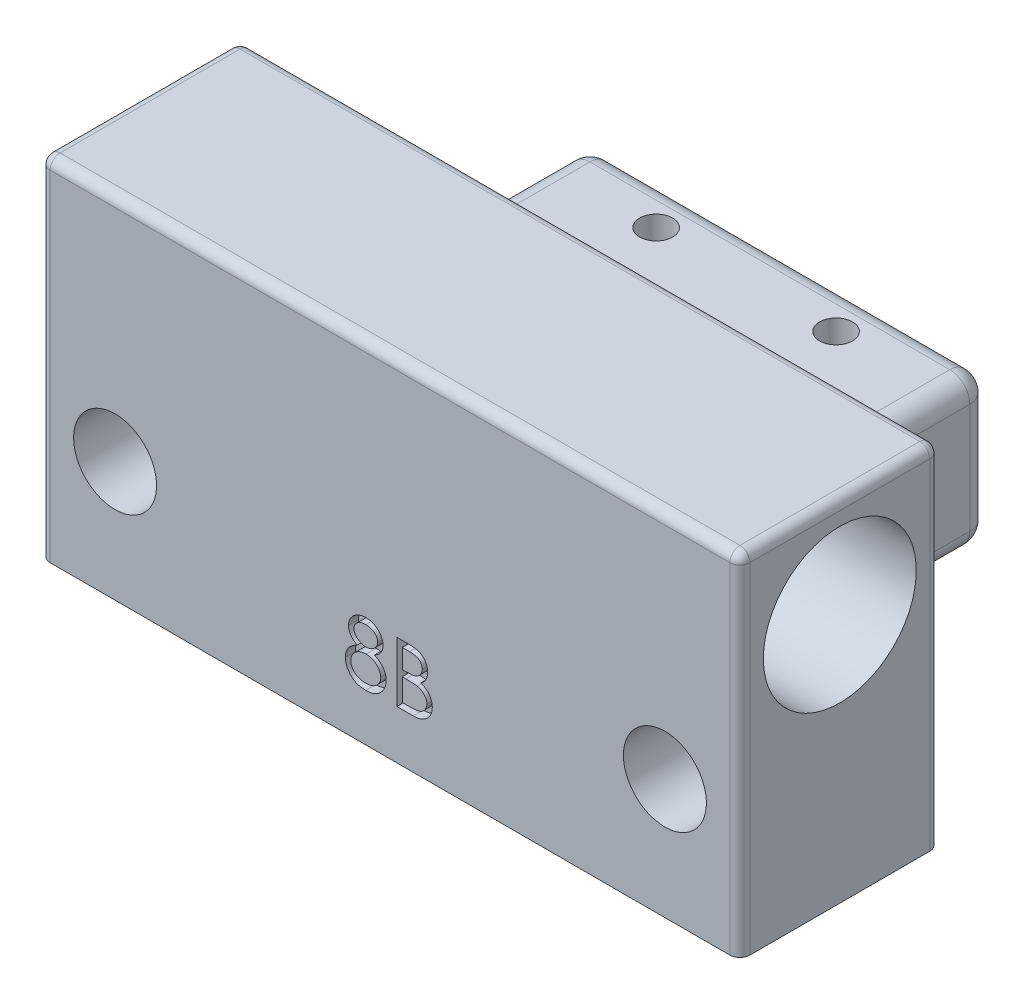
from build123d import *

# Parameters (mm, degrees)
CROQUIS1_W              = 70
CROQUIS1_H              = 20
SALIENTE_EXTRUIR1_DEPTH = 35
CROQUIS2_R              = 7.65
CORTAR_EXTRUIR1_DEPTH   = 79.89866919
CROQUIS3_R              = 4.15
CORTAR_EXTRUIR2_DEPTH   = 54.38539126
REDONDEO1_R             = 1
CROQUIS5_W              = 40
CROQUIS5_H              = 15
SALIENTE_EXTRUIR3_DEPTH = 20
REDONDEO3_R             = 2
CORTAR_EXTRUIR3_REACH   = 53.844
CROQUIS6_R              = 1.65
CORTAR_EXTRUIR4_DEPTH   = 1


with BuildPart() as part:
    # Croquis1 → Saliente-Extruir1 (new body)
    with BuildSketch(Plane(origin=(0, 0, 0), x_dir=(1, 0, 0), z_dir=(0, 1, 0))):
        Rectangle(CROQUIS1_W, CROQUIS1_H)
    extrude(amount=SALIENTE_EXTRUIR1_DEPTH)

    # Croquis2 → Cortar-Extruir1 (cut, through all)
    with BuildSketch(Plane.ZY.offset(35)):
        with Locations((0, 25)):
            Circle(CROQUIS2_R)
    extrude(amount=-CORTAR_EXTRUIR1_DEPTH, mode=Mode.SUBTRACT)

    # Croquis3 → Cortar-Extruir2 (cut, through all)
    with BuildSketch(Plane(origin=(0, 0, -10), x_dir=(-1, 0, 0), z_dir=(0, 0, -1))):
        with Locations((-27.5, 12)):
            Circle(CROQUIS3_R)
        with Locations((27.5, 12)):
            Circle(CROQUIS3_R)
    extrude(amount=-CORTAR_EXTRUIR2_DEPTH, mode=Mode.SUBTRACT)

    # Redondeo1
    redondeo1_edges = [part.edges().sort_by_distance(p)[0] for p in [
        (-35, 35, 0),
        (0, 35, 10),
        (35, 35, 0),
        (0, 35, -10),
        (35, 17.5, 10),
        (-35, 17.5, 10),
        (-35, 17.5, -10),
        (35, 17.5, -10),
    ]]
    fillet(redondeo1_edges, radius=REDONDEO1_R)

    # Croquis5 → Saliente-Extruir3 (add)
    with BuildSketch(Plane(origin=(0, 0, -10), x_dir=(-1, 0, 0), z_dir=(0, 0, -1))):
        with Locations((0, 16.2232378)):
            Rectangle(CROQUIS5_W, CROQUIS5_H)
    extrude(amount=SALIENTE_EXTRUIR3_DEPTH)

    # Redondeo3
    redondeo3_edges = [part.edges().sort_by_distance(p)[0] for p in [
        (-20, 16.2232378, -10),
        (-20, 8.7232378, -20),
        (0, 23.7232378, -10),
        (-20, 23.7232378, -20),
        (20, 16.2232378, -10),
        (20, 23.7232378, -20),
        (0, 8.7232378, -10),
        (20, 8.7232378, -20),
        (-20, 16.2232378, -30),
        (0, 23.7232378, -30),
        (20, 16.2232378, -30),
        (0, 8.7232378, -30),
    ]]
    fillet(redondeo3_edges, radius=REDONDEO3_R)

    # Croquis6 → Cortar-Extruir3 (cut, up to next)
    with BuildSketch(Plane(origin=(0, 23.7232378, 0), x_dir=(1, 0, 0), z_dir=(0, 1, 0)), mode=Mode.PRIVATE) as cortar_extruir3_sk1:
        with Locations(Location((9, 14.375, 0), (0, 0, 270))):
            Circle(CROQUIS6_R)
    cortar_extruir3_tool1 = extrude(cortar_extruir3_sk1.sketch, amount=-CORTAR_EXTRUIR3_REACH, mode=Mode.PRIVATE) & part.part
    # Croquis6 → Cortar-Extruir3 (cut, up to next)
    with BuildSketch(Plane(origin=(0, 23.7232378, 0), x_dir=(1, 0, 0), z_dir=(0, 1, 0)), mode=Mode.PRIVATE) as cortar_extruir3_sk2:
        with Locations(Location((9, 25.625, 0), (0, 0, 270))):
            Circle(CROQUIS6_R)
    cortar_extruir3_tool2 = extrude(cortar_extruir3_sk2.sketch, amount=-CORTAR_EXTRUIR3_REACH, mode=Mode.PRIVATE) & part.part
    # Croquis6 → Cortar-Extruir3 (cut, up to next)
    with BuildSketch(Plane(origin=(0, 23.7232378, 0), x_dir=(1, 0, 0), z_dir=(0, 1, 0)), mode=Mode.PRIVATE) as cortar_extruir3_sk3:
        with Locations(Location((-9, 25.625, 0), (0, 0, 270))):
            Circle(CROQUIS6_R)
    cortar_extruir3_tool3 = extrude(cortar_extruir3_sk3.sketch, amount=-CORTAR_EXTRUIR3_REACH, mode=Mode.PRIVATE) & part.part
    # Croquis6 → Cortar-Extruir3 (cut, up to next)
    with BuildSketch(Plane(origin=(0, 23.7232378, 0), x_dir=(1, 0, 0), z_dir=(0, 1, 0)), mode=Mode.PRIVATE) as cortar_extruir3_sk4:
        with Locations(Location((-9, 14.375, 0), (0, 0, 270))):
            Circle(CROQUIS6_R)
    cortar_extruir3_tool4 = extrude(cortar_extruir3_sk4.sketch, amount=-CORTAR_EXTRUIR3_REACH, mode=Mode.PRIVATE) & part.part
    add(cortar_extruir3_tool1.solids().sort_by_distance((9, 23.723238, -14.375))[0], mode=Mode.SUBTRACT)
    add(cortar_extruir3_tool2.solids().sort_by_distance((9, 23.723238, -25.625))[0], mode=Mode.SUBTRACT)
    add(cortar_extruir3_tool3.solids().sort_by_distance((-9, 23.723238, -25.625))[0], mode=Mode.SUBTRACT)
    add(cortar_extruir3_tool4.solids().sort_by_distance((-9, 23.723238, -14.375))[0], mode=Mode.SUBTRACT)

    # Croquis7 → Cortar-Extruir4 (cut)
    # profile 1 of 2: a face of its own
    with BuildSketch(Plane.XY.offset(10)):
        with BuildLine():
            add(Edge.make_bspline(
                [(-1.544471154, 8.228996938), (-1.495359359, 8.203389014), (-1.399574957, 8.153445009), (-1.263156885, 8.073026447), (-1.138485455, 7.988270507), (-1.022101634, 7.903180462), (-0.916050176, 7.814497631), (-0.821516897, 7.721869364), (-0.736166691, 7.627607743), (-0.661720776, 7.530116589), (-0.596240484, 7.429654904), (-0.539648252, 7.325959008), (-0.491275905, 7.21925615), (-0.452939438, 7.108381584), (-0.421359224, 6.994963993), (-0.399629615, 6.877538881), (-0.387943471, 6.756880011), (-0.385734076, 6.675334351), (-0.384615385, 6.634045015)],
                knots=[0, 0, 0, 0, 1.272397273, 2.481599622, 3.635517121, 4.734568067, 5.792894095, 6.808321871, 7.773003508, 8.711915296, 9.623354172, 10.525449501, 11.423591555, 12.311487226, 13.218079475, 14.126165749, 15.051214107, 16, 16, 16, 16], degree=3))
            add(Edge.make_bspline(
                [(-0.384615385, 6.634045015), (-0.38593782, 6.576277473), (-0.388555415, 6.461933833), (-0.411355388, 6.293169071), (-0.445491922, 6.129263159), (-0.495342515, 5.970252032), (-0.559994042, 5.817013106), (-0.639668618, 5.669415209), (-0.729859255, 5.52503925), (-0.802291666, 5.43620599), (-0.838942308, 5.391256554)],
                knots=[0, 0, 0, 0, 1.025265484, 2.029385089, 3.018602448, 3.995076438, 4.983346944, 5.966715145, 6.97116228, 8, 8, 8, 8], degree=3))
            add(Edge.make_bspline(
                [(-0.838942308, 5.391256554), (-0.886661978, 5.338810084), (-0.981511633, 5.234565239), (-1.143996652, 5.099220993), (-1.322319881, 4.985479175), (-1.515791309, 4.892784498), (-1.723893768, 4.820637312), (-1.946582919, 4.768792995), (-2.184292895, 4.739097402), (-2.347673703, 4.734804849), (-2.431490385, 4.732602707)],
                knots=[0, 0, 0, 0, 0.954267603, 1.896743057, 2.838368354, 3.796610408, 4.779680527, 5.799409237, 6.871065594, 8, 8, 8, 8], degree=3))
            add(Edge.make_bspline(
                [(-2.431490385, 4.732602707), (-2.512084765, 4.734578384), (-2.668913243, 4.73842285), (-2.897183891, 4.764470447), (-3.109966296, 4.810118218), (-3.30849767, 4.872594691), (-3.491581145, 4.953869368), (-3.658695032, 5.05502664), (-3.812250413, 5.171994827), (-3.947587225, 5.308133247), (-4.067738843, 5.453946742), (-4.173284077, 5.604378073), (-4.261011069, 5.759440972), (-4.335286089, 5.916823316), (-4.392145557, 6.078731008), (-4.431526489, 6.244331031), (-4.456536741, 6.413334133), (-4.459864401, 6.527388396), (-4.461538462, 6.584766169)],
                knots=[0, 0, 0, 0, 1.256902934, 2.445805442, 3.576955095, 4.645999104, 5.686449165, 6.692658513, 7.68621702, 8.689161843, 9.678783111, 10.630372946, 11.551080876, 12.453998257, 13.34127905, 14.221779781, 15.105423033, 16, 16, 16, 16], degree=3))
            add(Edge.make_bspline(
                [(-4.461538462, 6.584766169), (-4.460547808, 6.626867641), (-4.458589928, 6.71007501), (-4.44503876, 6.833005287), (-4.423252826, 6.952655804), (-4.393665186, 7.069468507), (-4.353566283, 7.182592974), (-4.305151198, 7.292565215), (-4.248696422, 7.399509385), (-4.183414425, 7.504010324), (-4.107468098, 7.604603773), (-4.02147327, 7.702996907), (-3.923711209, 7.797662965), (-3.815269508, 7.88975855), (-3.697387441, 7.980917362), (-3.567003103, 8.066212897), (-3.427572929, 8.151683694), (-3.328477948, 8.20278368), (-3.277644231, 8.228996938)],
                knots=[0, 0, 0, 0, 0.941657376, 1.861047343, 2.762797495, 3.66048619, 4.553285746, 5.444104102, 6.34607688, 7.256116206, 8.197091036, 9.162375105, 10.176350973, 11.237807142, 12.343728897, 13.50695164, 14.721116704, 16, 16, 16, 16], degree=3))
            add(Edge.make_bspline(
                [(-3.277644231, 8.228996938), (-3.347229444, 8.266942256), (-3.481965895, 8.340415012), (-3.660370651, 8.475409536), (-3.81361172, 8.621617219), (-3.93747695, 8.782125439), (-4.034972198, 8.95192008), (-4.101861235, 9.129938799), (-4.14711235, 9.312880707), (-4.151594911, 9.437862759), (-4.153846154, 9.500631554)],
                knots=[0, 0, 0, 0, 1.166880483, 2.259407225, 3.286803203, 4.280235371, 5.237608625, 6.161067461, 7.076446754, 8, 8, 8, 8], degree=3))
            add(Edge.make_bspline(
                [(-4.153846154, 9.500631554), (-4.15104257, 9.564570225), (-4.145406877, 9.693098105), (-4.09983547, 9.884422888), (-4.025572499, 10.072337), (-3.924565075, 10.25592965), (-3.798758419, 10.428987161), (-3.647821483, 10.584200212), (-3.475358689, 10.720162753), (-3.282230917, 10.834293335), (-3.07439737, 10.927179607), (-2.855113272, 10.991256904), (-2.628199283, 11.033147389), (-2.47374605, 11.037890226), (-2.395432692, 11.040295015)],
                knots=[0, 0, 0, 0, 0.888701115, 1.786444228, 2.72001202, 3.692817113, 4.693886446, 5.687152267, 6.695133018, 7.739871481, 8.800368666, 9.853104506, 10.91144658, 12, 12, 12, 12], degree=3))
            add(Edge.make_bspline(
                [(-2.395432692, 11.040295015), (-2.319140438, 11.03781557), (-2.168700804, 11.032926386), (-1.947567157, 10.992148881), (-1.735981653, 10.924041133), (-1.53467394, 10.831645893), (-1.347247882, 10.717839708), (-1.181643923, 10.580009639), (-1.035359497, 10.425481266), (-0.914357678, 10.252476232), (-0.814649868, 10.069589043), (-0.745219751, 9.87823615), (-0.700730653, 9.682552049), (-0.695119172, 9.550144042), (-0.692307692, 9.48380463)],
                knots=[0, 0, 0, 0, 1.072916533, 2.115669174, 3.151510826, 4.193348718, 5.225979165, 6.227137561, 7.216255879, 8.211077061, 9.189680878, 10.138522389, 11.067357538, 12, 12, 12, 12], degree=3))
            add(Edge.make_bspline(
                [(-0.692307692, 9.48380463), (-0.694766939, 9.418701778), (-0.69959676, 9.290843476), (-0.740225228, 9.104455156), (-0.808648051, 8.929903089), (-0.902066616, 8.765206599), (-1.023824595, 8.613352604), (-1.172296709, 8.472410084), (-1.346299243, 8.341221235), (-1.477032191, 8.267187468), (-1.544471154, 8.228996938)],
                knots=[0, 0, 0, 0, 0.975232327, 1.915300861, 2.843280834, 3.77672583, 4.742871857, 5.749627742, 6.839139064, 8, 8, 8, 8], degree=3))
        make_face()
        with BuildLine():
            add(Edge.make_bspline(
                [(-2.425480769, 10.4249104), (-2.467567865, 10.423793644), (-2.549908627, 10.421608783), (-2.670643492, 10.410193977), (-2.785453264, 10.387988462), (-2.895537494, 10.358436385), (-2.999386886, 10.31851412), (-3.098411837, 10.271551247), (-3.19092702, 10.214455135), (-3.278049253, 10.150407367), (-3.356479152, 10.079962385), (-3.426086955, 10.006567438), (-3.48390658, 9.928781052), (-3.533005624, 9.84853815), (-3.568631083, 9.763457162), (-3.595312747, 9.676146574), (-3.613349418, 9.585503058), (-3.614700944, 9.523554754), (-3.615384615, 9.492218092)],
                knots=[0, 0, 0, 0, 1.203892937, 2.355340988, 3.463153438, 4.544400666, 5.610487187, 6.640501085, 7.674077295, 8.714426146, 9.728707835, 10.68524104, 11.601827946, 12.495867327, 13.368432065, 14.231010473, 15.105153427, 16, 16, 16, 16], degree=3))
            add(Edge.make_bspline(
                [(-3.615384615, 9.492218092), (-3.614206272, 9.460880076), (-3.611877697, 9.398951653), (-3.593868906, 9.307501597), (-3.567028583, 9.217635935), (-3.524770306, 9.131491516), (-3.474085121, 9.046080043), (-3.411528305, 8.963536181), (-3.336975685, 8.883572664), (-3.252928645, 8.806869622), (-3.161366009, 8.735043171), (-3.064364792, 8.672689146), (-2.963142406, 8.620516385), (-2.858738859, 8.577094548), (-2.750090092, 8.54334037), (-2.637861852, 8.519394119), (-2.522035277, 8.504510695), (-2.443554281, 8.502732945), (-2.403846154, 8.501833477)],
                knots=[0, 0, 0, 0, 0.873023192, 1.725219244, 2.590779336, 3.480155217, 4.391973325, 5.357036234, 6.360879153, 7.436073238, 8.526419356, 9.601555421, 10.645666583, 11.697338044, 12.750135903, 13.812665442, 14.89329948, 16, 16, 16, 16], degree=3))
            add(Edge.make_bspline(
                [(-2.403846154, 8.501833477), (-2.352845976, 8.50332982), (-2.251349346, 8.506307728), (-2.101727634, 8.533995455), (-1.956248815, 8.577548457), (-1.816467836, 8.63713697), (-1.686002833, 8.711927587), (-1.569705573, 8.801469904), (-1.468568043, 8.903696356), (-1.383641282, 9.017015503), (-1.317795831, 9.137618226), (-1.266535589, 9.258647299), (-1.236602077, 9.381393981), (-1.232697677, 9.463623062), (-1.230769231, 9.504237323)],
                knots=[0, 0, 0, 0, 1.076279235, 2.141928126, 3.20205304, 4.278698113, 5.344010996, 6.36967002, 7.368914609, 8.37248503, 9.349703398, 10.264243087, 11.142681841, 12, 12, 12, 12], degree=3))
            add(Edge.make_bspline(
                [(-1.230769231, 9.504237323), (-1.231681055, 9.532742527), (-1.233490896, 9.589321272), (-1.248405278, 9.672872756), (-1.273049563, 9.75452347), (-1.306414843, 9.834947934), (-1.350317348, 9.913017761), (-1.402370241, 9.989960197), (-1.465600815, 10.064044364), (-1.536566129, 10.136996733), (-1.617043973, 10.204512202), (-1.706879251, 10.263885991), (-1.805611394, 10.314307174), (-1.913242737, 10.355259325), (-2.029376893, 10.386017638), (-2.153478963, 10.409051377), (-2.286583729, 10.422033854), (-2.378177588, 10.423930755), (-2.425480769, 10.4249104)],
                knots=[0, 0, 0, 0, 0.814439003, 1.616544685, 2.417341072, 3.248991801, 4.09997495, 4.973547432, 5.9003056, 6.880240646, 7.880314356, 8.896779544, 9.951930927, 11.043077905, 12.18215768, 13.381699519, 14.647792085, 16, 16, 16, 16], degree=3))
        make_face(mode=Mode.SUBTRACT)
        with BuildLine():
            add(Edge.make_bspline(
                [(-2.390625, 7.886448861), (-2.44398349, 7.885499762), (-2.548659826, 7.88363786), (-2.70201456, 7.862913002), (-2.849191415, 7.834062614), (-2.989694164, 7.790295462), (-3.123463472, 7.733387193), (-3.2512235, 7.664927982), (-3.371996865, 7.584004365), (-3.484115824, 7.491644453), (-3.586498675, 7.39211396), (-3.676324332, 7.2867503), (-3.752605795, 7.177511672), (-3.814034226, 7.063010708), (-3.864454338, 6.945671947), (-3.897563841, 6.822573212), (-3.918789633, 6.696081018), (-3.921639858, 6.610092278), (-3.923076923, 6.566737323)],
                knots=[0, 0, 0, 0, 1.140299081, 2.23698856, 3.303958914, 4.344563908, 5.37730929, 6.408454204, 7.439741482, 8.480804886, 9.510774543, 10.48932336, 11.43758569, 12.353841022, 13.263987381, 14.161954604, 15.073269652, 16, 16, 16, 16], degree=3))
            add(Edge.make_bspline(
                [(-3.923076923, 6.566737323), (-3.920739908, 6.512855769), (-3.916103325, 6.405956027), (-3.879320515, 6.24796219), (-3.820288169, 6.09501181), (-3.737959227, 5.94835132), (-3.636014817, 5.811293995), (-3.510655158, 5.691827522), (-3.369670864, 5.585676416), (-3.208291686, 5.499824073), (-3.032014316, 5.431261465), (-2.840885638, 5.384022671), (-2.637648634, 5.352751614), (-2.497317905, 5.349600447), (-2.425480769, 5.347987323)],
                knots=[0, 0, 0, 0, 0.898778495, 1.783155532, 2.693654817, 3.627872908, 4.583023416, 5.533784346, 6.509005473, 7.520592997, 8.575161974, 9.658835044, 10.801527049, 12, 12, 12, 12], degree=3))
            add(Edge.make_bspline(
                [(-2.425480769, 5.347987323), (-2.369337281, 5.34906528), (-2.259951763, 5.351165487), (-2.100375851, 5.369704277), (-1.949785196, 5.399103633), (-1.808471827, 5.441863998), (-1.674853816, 5.494063957), (-1.551196638, 5.561216097), (-1.434319163, 5.637591508), (-1.329980667, 5.728205491), (-1.234952309, 5.825027482), (-1.152095236, 5.927524699), (-1.080168005, 6.032911497), (-1.023714938, 6.14356947), (-0.978584218, 6.25737561), (-0.946143838, 6.375379343), (-0.926127469, 6.4979426), (-0.924103076, 6.581083865), (-0.923076923, 6.623227707)],
                knots=[0, 0, 0, 0, 1.224942928, 2.386581632, 3.501229538, 4.569074225, 5.605009692, 6.626002462, 7.634866581, 8.645888296, 9.63523824, 10.59253846, 11.518950513, 12.414518923, 13.29783783, 14.186679152, 15.080837789, 16, 16, 16, 16], degree=3))
            add(Edge.make_bspline(
                [(-0.923076923, 6.623227707), (-0.924629806, 6.664160291), (-0.927691821, 6.744872196), (-0.947126149, 6.864471956), (-0.981267652, 6.980019638), (-1.028114618, 7.092905362), (-1.090481983, 7.200841849), (-1.163930332, 7.306641), (-1.252548821, 7.407366334), (-1.3526847, 7.503800213), (-1.461814347, 7.592970047), (-1.577815167, 7.671851942), (-1.699794244, 7.738284141), (-1.827493463, 7.792312419), (-1.960629273, 7.834805224), (-2.099103751, 7.864489787), (-2.243079022, 7.883174821), (-2.340887372, 7.885345185), (-2.390625, 7.886448861)],
                knots=[0, 0, 0, 0, 0.917430815, 1.809013306, 2.70690318, 3.612392954, 4.541220862, 5.495268465, 6.494511384, 7.542276156, 8.608045339, 9.649016899, 10.681629292, 11.715607085, 12.752076957, 13.808767841, 14.885711793, 16, 16, 16, 16], degree=3))
        make_face(mode=Mode.SUBTRACT)
    # profile 2 of 2: a face of its own
    with BuildSketch(Plane.XY.offset(10)):
        with BuildLine():
            Line((0.692307692, 10.886448861), (1.862980769, 10.886448861))
            add(Edge.make_bspline(
                [(1.862980769, 10.886448861), (1.920286732, 10.886147575), (2.03135995, 10.885563607), (2.192878993, 10.876506811), (2.344162668, 10.864157662), (2.485254849, 10.844563218), (2.616090339, 10.820920171), (2.737063431, 10.792288486), (2.847789441, 10.757957149), (2.979982703, 10.703363524), (3.130703836, 10.622238092), (3.293901081, 10.502360552), (3.433451206, 10.355733472), (3.553770607, 10.190334635), (3.649429669, 10.008387597), (3.718634179, 9.814228988), (3.762447679, 9.610363145), (3.766953566, 9.470403411), (3.769230769, 9.399670015)],
                knots=[0, 0, 0, 0, 1.001505555, 1.941167018, 2.826882275, 3.653841531, 4.429895133, 5.150066043, 5.825578002, 6.45369114, 7.647487171, 8.808567382, 9.977351308, 11.170798116, 12.373658725, 13.556498008, 14.765093433, 16, 16, 16, 16], degree=3))
            add(Edge.make_bspline(
                [(3.769230769, 9.399670015), (3.76735668, 9.333408491), (3.763673919, 9.203198348), (3.72845776, 9.012751303), (3.673325186, 8.831463499), (3.596687616, 8.659996553), (3.497084194, 8.502224645), (3.379041362, 8.356875046), (3.236623986, 8.230101805), (3.129921289, 8.159228258), (3.075721154, 8.123227707)],
                knots=[0, 0, 0, 0, 1.044552857, 2.05264487, 3.044412934, 4.028983338, 5.005914585, 5.980388656, 6.974128949, 8, 8, 8, 8], degree=3))
            add(Edge.make_bspline(
                [(3.075721154, 8.123227707), (3.143881887, 8.097059138), (3.274290254, 8.046992182), (3.453751989, 7.958474243), (3.608371724, 7.86219634), (3.73933826, 7.757056025), (3.851345668, 7.643726635), (3.949150711, 7.52054644), (4.032604495, 7.385908569), (4.104112364, 7.241216794), (4.159910231, 7.087948563), (4.201697496, 6.927541518), (4.225641695, 6.760570852), (4.22904908, 6.646938773), (4.230769231, 6.589573861)],
                knots=[0, 0, 0, 0, 1.27268992, 2.434971085, 3.483601985, 4.442670788, 5.356604649, 6.2567628, 7.179492994, 8.113709626, 9.066344395, 10.018646069, 10.999752585, 12, 12, 12, 12], degree=3))
            add(Edge.make_bspline(
                [(4.230769231, 6.589573861), (4.229094638, 6.53100208), (4.225799829, 6.415760461), (4.201491306, 6.246465944), (4.160332836, 6.084680322), (4.103639443, 5.929357151), (4.029646903, 5.780796921), (3.939598964, 5.638831325), (3.83223057, 5.504886759), (3.712122794, 5.377474833), (3.576244831, 5.262912912), (3.429646394, 5.160885986), (3.270481274, 5.076978451), (3.10136357, 5.006493843), (2.920396171, 4.952652931), (2.728391701, 4.914985662), (2.525515755, 4.889605598), (2.386299039, 4.887518962), (2.314903846, 4.886448861)],
                knots=[0, 0, 0, 0, 0.978564426, 1.925352924, 2.850884081, 3.763762016, 4.682927383, 5.618979971, 6.567305752, 7.547517671, 8.540179244, 9.531824382, 10.526200242, 11.540722885, 12.589160233, 13.674978461, 14.80764778, 16, 16, 16, 16], degree=3))
            Line((2.314903846, 4.886448861), (0.692307692, 4.886448861))
            Line((0.692307692, 4.886448861), (0.692307692, 10.886448861))
        make_face()
        with BuildLine():
            Line((1.230769231, 10.271064246), (1.230769231, 8.347987323))
            Line((1.230769231, 8.347987323), (1.592548077, 8.347987323))
            add(Edge.make_bspline(
                [(1.592548077, 8.347987323), (1.645431726, 8.348672905), (1.747613713, 8.34999759), (1.895590679, 8.35379219), (2.032947853, 8.364417408), (2.159448138, 8.375039571), (2.274892328, 8.392310293), (2.379024662, 8.412868218), (2.4734794, 8.434610341), (2.582404335, 8.471586604), (2.705957961, 8.526234047), (2.837671854, 8.611042909), (2.953788087, 8.712056086), (3.051840409, 8.828612021), (3.132088644, 8.956954054), (3.187826441, 9.09503442), (3.225621786, 9.239411789), (3.22903584, 9.338528794), (3.230769231, 9.388852707)],
                knots=[0, 0, 0, 0, 1.156816544, 2.235205308, 3.236616184, 4.169592532, 5.011045266, 5.787822928, 6.49130361, 7.128639758, 8.301311294, 9.436451833, 10.541879658, 11.654887649, 12.756523258, 13.837046038, 14.901820046, 16, 16, 16, 16], degree=3))
            add(Edge.make_bspline(
                [(3.230769231, 9.388852707), (3.229867208, 9.42215403), (3.228097791, 9.487478211), (3.213606415, 9.582705675), (3.188976287, 9.672266394), (3.157340356, 9.757387726), (3.113131175, 9.83540804), (3.061079524, 9.909024947), (2.998189769, 9.975731436), (2.926605805, 10.038079147), (2.844305308, 10.093355481), (2.751337379, 10.141768218), (2.646444219, 10.180752406), (2.53139361, 10.214894382), (2.404414603, 10.238874314), (2.266972511, 10.25885155), (2.117941565, 10.269021965), (2.014835674, 10.270368301), (1.961538462, 10.271064246)],
                knots=[0, 0, 0, 0, 0.91205012, 1.789085906, 2.630437955, 3.453916878, 4.269457761, 5.079663411, 5.91843418, 6.774407191, 7.675494373, 8.627863946, 9.638891023, 10.736472738, 11.911756761, 13.175263542, 14.539845004, 16, 16, 16, 16], degree=3))
            Line((1.961538462, 10.271064246), (1.230769231, 10.271064246))
        make_face(mode=Mode.SUBTRACT)
        with BuildLine():
            Line((1.230769231, 7.732602707), (1.230769231, 5.501833477))
            Line((1.230769231, 5.501833477), (1.997596154, 5.501833477))
            add(Edge.make_bspline(
                [(1.997596154, 5.501833477), (2.052485741, 5.502491329), (2.158278184, 5.503759254), (2.31102315, 5.50789849), (2.452594185, 5.51731382), (2.582345275, 5.532135276), (2.70167748, 5.548212618), (2.809159256, 5.569831957), (2.905661874, 5.594601603), (3.017560687, 5.632888756), (3.143566701, 5.69236842), (3.279356741, 5.782049951), (3.4000874, 5.888889907), (3.502610702, 6.012542903), (3.586632968, 6.146996606), (3.647756605, 6.289531492), (3.685455217, 6.437792396), (3.690018936, 6.538878189), (3.692307692, 6.589573861)],
                knots=[0, 0, 0, 0, 1.160039823, 2.235823828, 3.228722157, 4.157150951, 4.99529583, 5.772374946, 6.472645482, 7.099169577, 8.269452708, 9.405989375, 10.527446681, 11.663510218, 12.788923519, 13.866172445, 14.929861265, 16, 16, 16, 16], degree=3))
            add(Edge.make_bspline(
                [(3.692307692, 6.589573861), (3.691834371, 6.621276731), (3.690895362, 6.684171099), (3.676734308, 6.776598218), (3.656139102, 6.866128287), (3.629513787, 6.953004413), (3.590737558, 7.035655915), (3.545469195, 7.115717446), (3.492392506, 7.193294839), (3.409688222, 7.291372988), (3.289393391, 7.404373582), (3.118467491, 7.5150093), (2.92411498, 7.604234112), (2.783153563, 7.642118929), (2.710336538, 7.661689246)],
                knots=[0, 0, 0, 0, 0.723448775, 1.435228256, 2.130040452, 2.821711965, 3.505591119, 4.210454504, 4.921174351, 5.648778258, 7.137944449, 8.670945889, 10.280296675, 12, 12, 12, 12], degree=3))
            add(Edge.make_bspline(
                [(2.710336538, 7.661689246), (2.681143803, 7.667612247), (2.61784793, 7.680454535), (2.514634935, 7.694010598), (2.396802017, 7.706087843), (2.264077085, 7.715021257), (2.116292214, 7.724255331), (1.953131782, 7.727846453), (1.7752621, 7.732130899), (1.651846604, 7.732441415), (1.587740385, 7.732602707)],
                knots=[0, 0, 0, 0, 0.634451884, 1.375622551, 2.216452059, 3.157844607, 4.20941857, 5.370758133, 6.634282058, 8, 8, 8, 8], degree=3))
            Line((1.587740385, 7.732602707), (1.230769231, 7.732602707))
        make_face(mode=Mode.SUBTRACT)
    extrude(amount=-CORTAR_EXTRUIR4_DEPTH, mode=Mode.SUBTRACT)


solid = part.part
